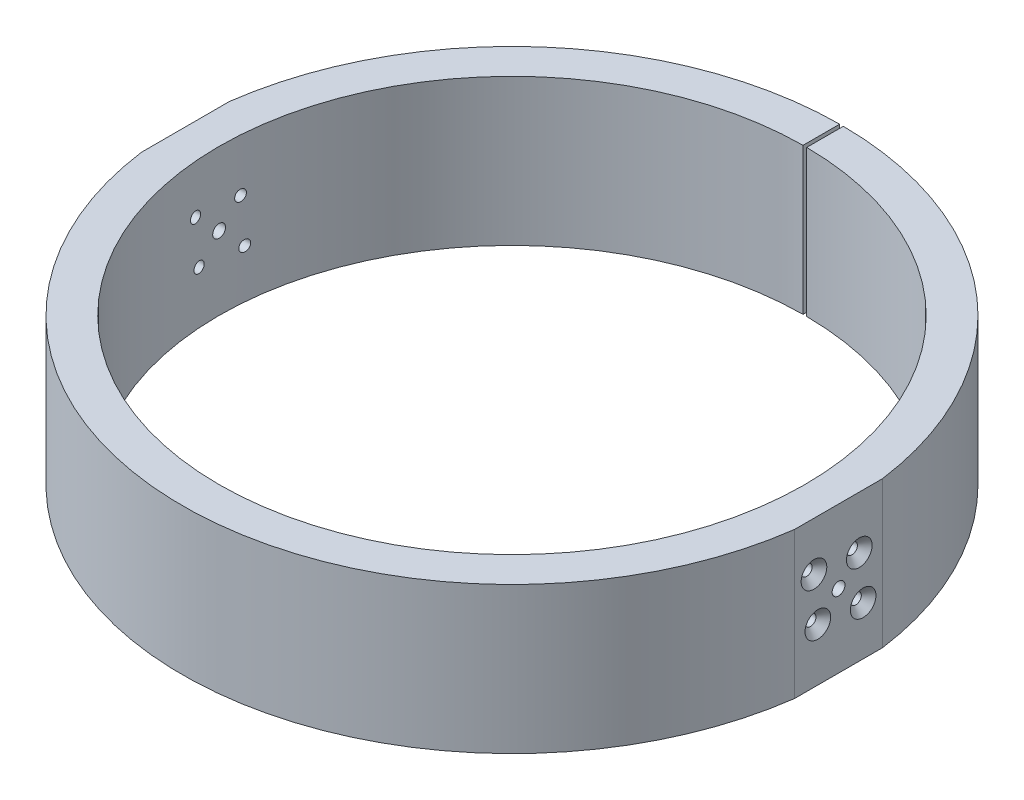
from build123d import *

# Parameters (mm, degrees)
SKETCH1_R               = 90
SKETCH1_R_2             = 80
BOSS_EXTRUDE1_DEPTH     = 40
CUT_EXTRUDE1_START      = -70
CUT_EXTRUDE1_DEPTH      = 70
SKETCH3_R               = 1.5
SKETCH3_R_2             = 1.75
CUT_EXTRUDE2_DEPTH      = 212
CHAMFER1_SIZE           = 2
CUT_EXTRUDE4_DEPTH      = 133.875882032
CUT_EXTRUDE4_DEPTH_BACK = 10
SKETCH4_W               = 1
SKETCH4_H               = 86.76850885


with BuildPart() as part:
    # Sketch1 → Boss-Extrude1 (new body)
    with BuildSketch(Plane(origin=(0, 0, 0), x_dir=(1, 0, 0), z_dir=(0, 1, 0))):
        with Locations(Location((0, 0, 0), (0, 0, 270))):
            Circle(SKETCH1_R)
        with Locations(Location((0, 0, 0), (0, 0, 270))):
            Circle(SKETCH1_R_2, mode=Mode.SUBTRACT)
    extrude(amount=BOSS_EXTRUDE1_DEPTH)

    # Sketch2 → Cut-Extrude1 (cut)
    with BuildSketch(Plane(origin=(0, 40, 0), x_dir=(1, 0, 0), z_dir=(0, 1, 0)).offset(CUT_EXTRUDE1_START)):
        with BuildLine():
            Line((-89.196412484, 12), (-89.196412484, -12))
            ThreePointArc((-89.196412484, -12), (-90, 0), (-89.196412484, 12))
        make_face()
        with BuildLine():
            Line((89.196412484, 12), (89.196412484, -12))
            ThreePointArc((89.196412484, -12), (90, 0), (89.196412484, 12))
        make_face()
    extrude(amount=CUT_EXTRUDE1_DEPTH, mode=Mode.SUBTRACT)

    # Sketch3 → Cut-Extrude2 (cut)
    with BuildSketch(Plane.ZY.offset(89.196412484)):
        with Locations((6.717514421, 26.717514421)):
            Circle(SKETCH3_R)
        with Locations((-5.656854249, 25.656854249)):
            Circle(SKETCH3_R)
        with Locations((-6.717514421, 13.282485579)):
            Circle(SKETCH3_R)
        with Locations((5.656854249, 14.343145751)):
            Circle(SKETCH3_R)
        with Locations((0, 20)):
            Circle(SKETCH3_R_2)
    extrude(amount=-CUT_EXTRUDE2_DEPTH, mode=Mode.SUBTRACT)

    # Chamfer1
    chamfer1_edges = [part.edges().sort_by_distance(p)[0] for p in [
        (89.196412484, 13.282485579, -8.217514421),
        (-89.196412484, 13.282485579, -8.217514421),
        (89.196412484, 26.717514421, 5.217514421),
        (-89.196412484, 26.717514421, 5.217514421),
        (89.196412484, 14.343145751, 4.156854249),
        (-89.196412484, 14.343145751, 4.156854249),
        (89.196412484, 25.656854249, -7.156854249),
        (-89.196412484, 25.656854249, -7.156854249),
    ]]
    chamfer(chamfer1_edges, length=CHAMFER1_SIZE)

    # Sketch4 → Cut-Extrude4 (cut, two sides: drawn at the far end of the back side and taken through both)
    with BuildSketch(Plane(origin=(0, 0, 0), x_dir=(1, 0, 0), z_dir=(0, 1, 0)).offset(-CUT_EXTRUDE4_DEPTH_BACK)):
        with Locations((0, 48.982222738)):
            Rectangle(SKETCH4_W, SKETCH4_H)
    extrude(amount=CUT_EXTRUDE4_DEPTH + CUT_EXTRUDE4_DEPTH_BACK, mode=Mode.SUBTRACT)


solid = part.part
